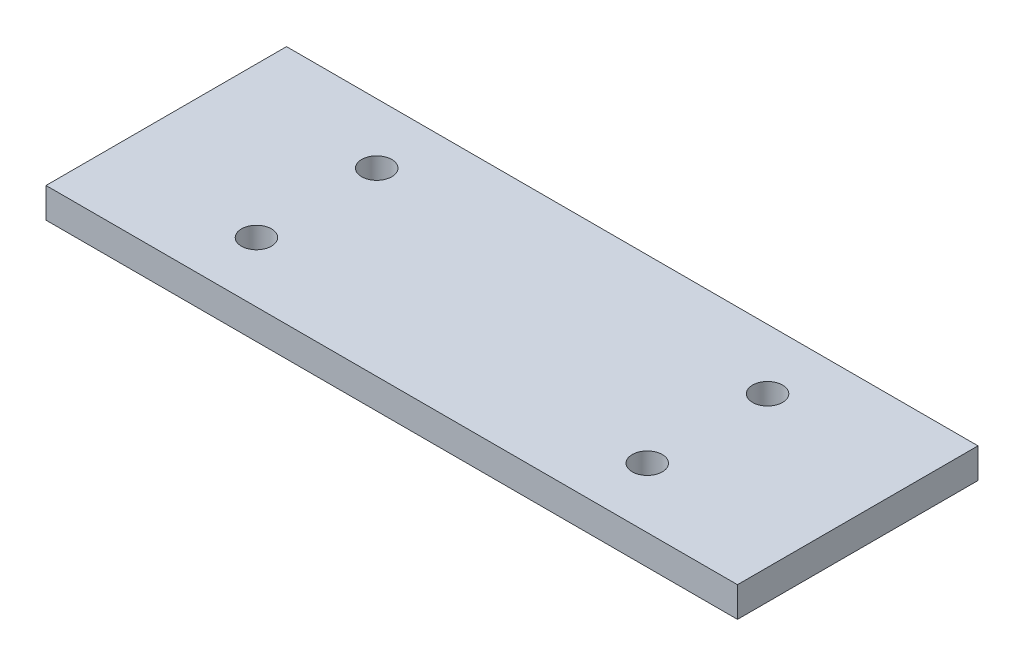
from build123d import *

# Parameters (mm, degrees)
SKETCH1_W           = 115
SKETCH1_H           = 40
SKETCH1_R           = 2.5
BOSS_EXTRUDE1_DEPTH = 5


with BuildPart() as part:
    # Sketch1 → Boss-Extrude1 (new body)
    with BuildSketch(Plane(origin=(0, 0, 0), x_dir=(1, 0, 0), z_dir=(0, 1, 0))):
        Rectangle(SKETCH1_W, SKETCH1_H)
        with Locations(Location((-32.5, 10, 0), (0, 0, 270))):
            Circle(SKETCH1_R, mode=Mode.SUBTRACT)
        with Locations(Location((-32.5, -10, 0), (0, 0, 90))):
            Circle(SKETCH1_R, mode=Mode.SUBTRACT)
        with Locations(Location((32.5, -10, 0), (0, 0, 270))):
            Circle(SKETCH1_R, mode=Mode.SUBTRACT)
        with Locations(Location((32.5, 10, 0), (0, 0, 90))):
            Circle(SKETCH1_R, mode=Mode.SUBTRACT)
    extrude(amount=BOSS_EXTRUDE1_DEPTH)


solid = part.part
